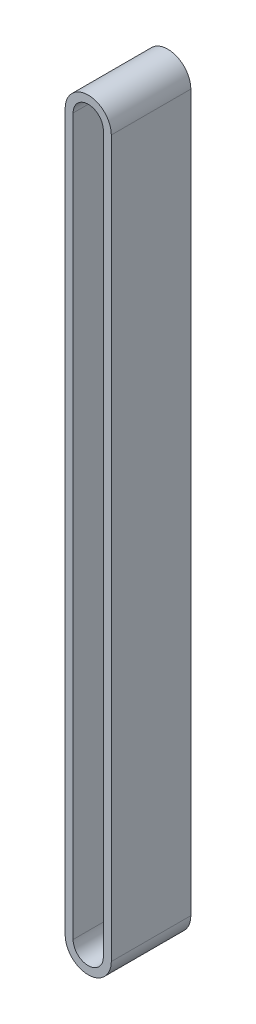
from build123d import *

# Parameters (mm, degrees)
SURFACE_EXTRUDE1_1_DEPTH = 10
THICKEN1_T1              = 1


with BuildPart() as body_1:
    # Surface-Extrude1: a surface, the sketch's curves swept straight by 10 mm
    with BuildLine(Plane.XY, mode=Mode.PRIVATE) as surface_extrude1_1_path:
        Line((-1.9, 0), (-1.9, 90))
        ThreePointArc((-1.9, 90), (0, 91.9), (1.9, 90))
        Line((1.9, 90), (1.9, 0))
        ThreePointArc((1.9, 0), (0, -1.9), (-1.9, 0))
    surface_extrude1_1 = Shell.extrude(surface_extrude1_1_path.wire(), (0 * SURFACE_EXTRUDE1_1_DEPTH, 0 * SURFACE_EXTRUDE1_1_DEPTH, 1 * SURFACE_EXTRUDE1_1_DEPTH))
    add(Solid.thicken(surface_extrude1_1, THICKEN1_T1))


solid = body_1.part
